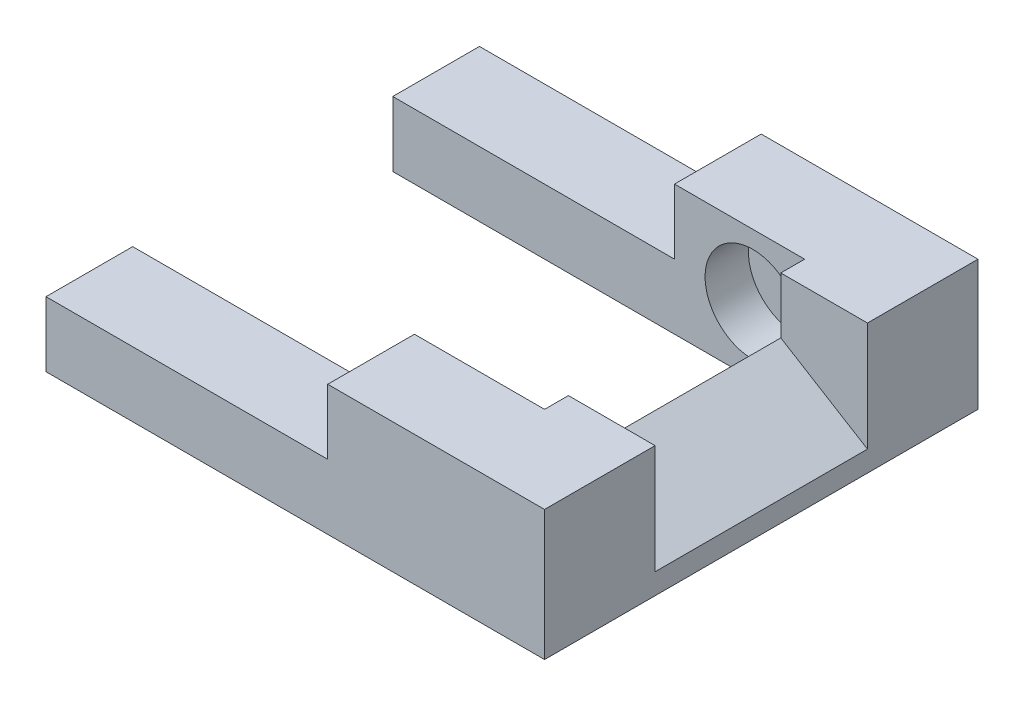
from build123d import *

# Parameters (mm, degrees)
IZIM1_W                          = 280
IZIM1_H                          = 100
IZIM1_W_2                        = 240
IZIM1_H_2                        = 60
Y_KSEKLIK_EKSTR_ZYON1_DEPTH      = 30
IZIM4_R                          = 11
KES_EKSTR_ZYON1_DEPTH            = 40
IZIM5_W                          = 65
IZIM5_H                          = 15
KES_EKSTR_ZYON2_DEPTH            = 119
KES_EKSTR_ZYON3_DEPTH            = 24.5
Y_KSEKLIK_EKSTR_ZYON4_DEPTH      = 8
Y_KSEKLIK_EKSTR_ZYON4_DEPTH_BACK = 1
IZIM13_R                         = 7.75
KES_EKSTR_ZYON4_DEPTH            = 18
IZIM14_W                         = 170.35585657
IZIM14_H                         = 104.641272027
KES_EKSTR_ZYON6_DEPTH            = 136


with BuildPart() as part:
    # Çizim1 → Yükseklik-Ekstrüzyon1 (new body)
    with BuildSketch(Plane(origin=(0, 0, 0), x_dir=(1, 0, 0), z_dir=(0, 1, 0))):
        with Locations((120, 30)):
            Rectangle(IZIM1_W, IZIM1_H)
        with Locations((120, 30)):
            Rectangle(IZIM1_W_2, IZIM1_H_2, mode=Mode.SUBTRACT)
    extrude(amount=Y_KSEKLIK_EKSTR_ZYON1_DEPTH)

    # Çizim4 → Kes-Ekstrüzyon1 (cut, symmetric)
    with BuildSketch(Plane.XY.offset(-30)):
        with Locations((228.036930768, 15)):
            Circle(IZIM4_R)
        with Locations((16.579541137, 15)):
            Circle(IZIM4_R)
        with Locations((95.469880506, 15)):
            Circle(IZIM4_R)
    extrude(amount=KES_EKSTR_ZYON1_DEPTH, both=True, mode=Mode.SUBTRACT)

    # Çizim5 → Kes-Ekstrüzyon2 (cut)
    with BuildSketch(Plane.XY.offset(20)):
        with Locations((177.478221097, 22.5)):
            Rectangle(IZIM5_W, IZIM5_H)
    extrude(amount=-KES_EKSTR_ZYON2_DEPTH, mode=Mode.SUBTRACT)

    # Çizim6 → Kes-Ekstrüzyon3 (cut, symmetric)
    with BuildSketch(Plane.XY.offset(-30)):
        Polygon((260, 31.552276972), (234.133246527, 31.552276972), (234.359911555, 20.467639669), (260, 4.801073138), align=None)
    extrude(amount=KES_EKSTR_ZYON3_DEPTH, both=True, mode=Mode.SUBTRACT)

    # Çizim10 → Yükseklik-Ekstrüzyon4 (add, two sides: drawn at the far end of the back side and taken through both)
    with BuildSketch(Plane(origin=(0, 22, 0), x_dir=(1, 0, 0), z_dir=(0, 1, 0)).offset(-Y_KSEKLIK_EKSTR_ZYON4_DEPTH_BACK)):
        Polygon((55.057032044, 60), (144.978221097, 21.175943648), (144.978221097, 60), align=None)
    extrude(amount=Y_KSEKLIK_EKSTR_ZYON4_DEPTH + Y_KSEKLIK_EKSTR_ZYON4_DEPTH_BACK)

    # Çizim13 → Kes-Ekstrüzyon4 (cut)
    with BuildSketch(Plane(origin=(0, 0, -80), x_dir=(-1, 0, 0), z_dir=(0, 0, -1))):
        with Locations((-16.579541137, 15)):
            Circle(IZIM13_R)
    extrude(amount=-KES_EKSTR_ZYON4_DEPTH, mode=Mode.SUBTRACT)

    # Çizim14 → Kes-Ekstrüzyon6 (cut)
    with BuildSketch(Plane(origin=(0, 30, 0), x_dir=(1, 0, 0), z_dir=(0, 1, 0))):
        with Locations((59.800292812, 32.320636013)):
            Rectangle(IZIM14_W, IZIM14_H)
    extrude(amount=-KES_EKSTR_ZYON6_DEPTH, mode=Mode.SUBTRACT)


solid = part.part
